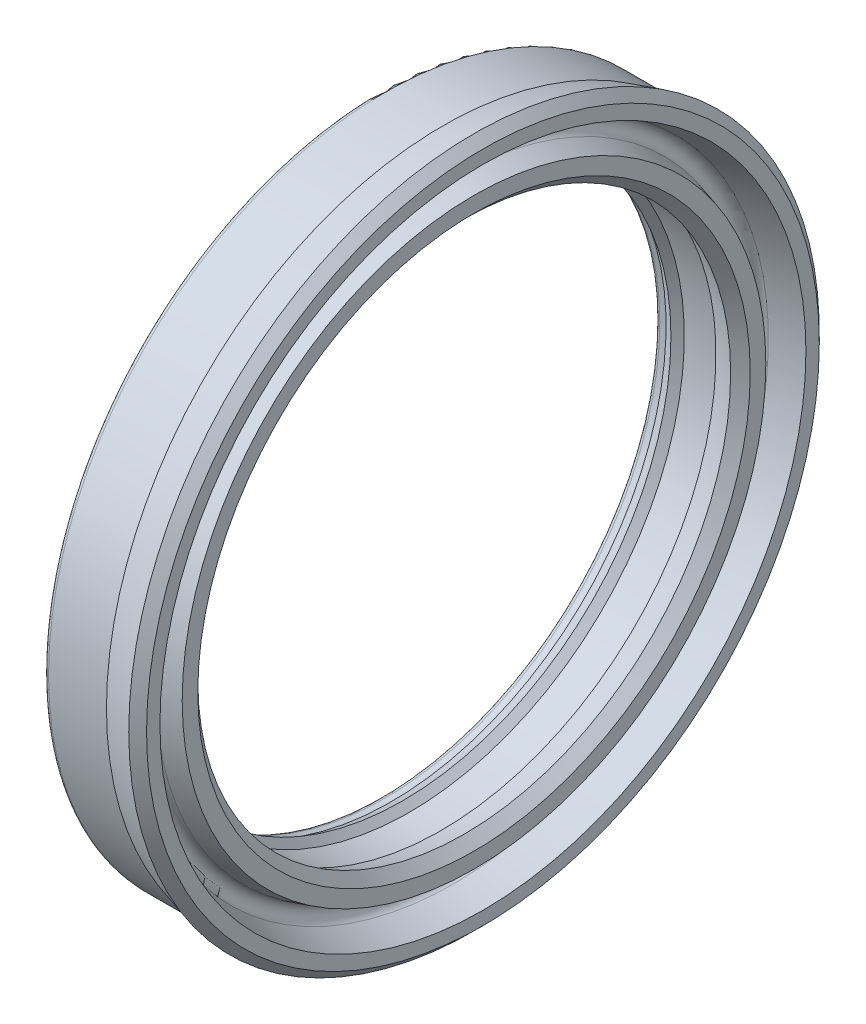
from build123d import *

# Parameters (mm, degrees)
FILLET1_R = 0.5


with BuildPart() as part:
    # Sketch1 → Revolve1 (revolve)
    with BuildSketch(Plane.XY, mode=Mode.PRIVATE) as revolve1_sk:
        with BuildLine():
            Line((0, 30.85), (0, 37.75))
            Line((0, 37.75), (7, 37.75))
            Line((7, 37.75), (10.5, 38.75))
            Line((10.5, 38.75), (11.5, 37.75))
            Line((11.5, 37.75), (11.5, 36.25))
            Line((11.5, 36.25), (8.224507889, 35.311303332))
            ThreePointArc((8.224507889, 35.311303332), (7.500003732, 34.347267981), (8.229764579, 33.387205724))
            Line((8.229764579, 33.387205724), (10.5, 32.75))
            Line((10.5, 32.75), (10.5, 31))
            Line((10.5, 31), (9.4, 29.9))
            Line((9.4, 29.9), (6.8, 30.85))
            Line((6.8, 30.85), (3.25, 30.85))
            Line((3.25, 30.85), (2.5, 30.1))
            Line((2.5, 30.1), (1.200961894, 30.85))
            Line((1.200961894, 30.85), (0, 30.85))
        make_face()
    revolve(revolve1_sk.sketch.rotate(Axis((0, 0, 0), (1, 0, 0)), 90), axis=Axis((0, 0, 0), (1, 0, 0)))

    # Fillet1
    fillet1_edges = [part.edges().sort_by_distance(p)[0] for p in [
        (0, 0, -30.85),
        (0, 0, -37.75),
    ]]
    fillet(fillet1_edges, radius=FILLET1_R)


solid = part.part
